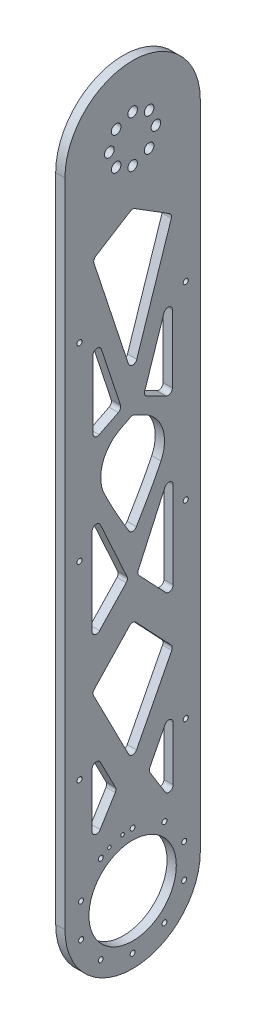
from build123d import *

# Parameters (mm, degrees)
SKETCH1_R                            = 3.3
SKETCH1_R_2                          = 1.7
SKETCH1_R_3                          = 26
BOSS_EXTRUDE1_DEPTH                  = 6.35
CUT_EXTRUDE1_DEPTH                   = 549.511460682
FILLET1_R                            = 3
SKETCH4_R                            = 1.75
CUT_EXTRUDE2_DEPTH                   = 549.511460792
SKETCH5_R                            = 1.2
CUT_EXTRUDE4_DEPTH                   = 549.511460792
BOSS_EXTRUDE2_START                  = -6.35
BOSS_EXTRUDE2_DEPTH                  = 6.35
TAP_DRILL_FOR_M3X0_5_TAP1_AT_2_COUNT = 2
TAP_DRILL_FOR_M3X0_5_TAP1_AT_2_PITCH = 13.03070812
CIRPATTERN1_COUNT                    = 2
CIRPATTERN1_ANGLE                    = 90
CUT_EXTRUDE5_DEPTH                   = 549.511460792
SKETCH10_R                           = 30
CUT_EXTRUDE6_DEPTH                   = 549.511460792
SKETCH11_W                           = 93
SKETCH11_H                           = 52.717688801
CUT_EXTRUDE7_DEPTH                   = 549.511460792
BOSS_EXTRUDE3_DEPTH                  = 6.35
SKETCH13_R                           = 1.75
CUT_EXTRUDE8_DEPTH                   = 549.511460792
SKETCH14_R                           = 1.75
BOSS_EXTRUDE4_DEPTH                  = 6.35


with BuildPart() as part:
    # Sketch1 → Boss-Extrude1 (new body)
    with BuildSketch(Plane(origin=(0, 0, 0), x_dir=(0, -1, 0), z_dir=(1, 0, 0))):
        with BuildLine():
            Line((0, 46.5), (500, 46.5))
            ThreePointArc((500, 46.5), (546.5, 0), (500, -46.5))
            Line((500, -46.5), (0, -46.5))
            ThreePointArc((0, -46.5), (-46.5, 0), (0, 46.5))
        make_face()
        with Locations(Location((-16, 0, 0), (0, 0, 90))):
            Circle(SKETCH1_R, mode=Mode.SUBTRACT)
        with Locations(Location((-11.313708499, 11.313708499, 0), (0, 0, 90))):
            Circle(SKETCH1_R, mode=Mode.SUBTRACT)
        with Locations(Location((0, 16, 0), (0, 0, 90))):
            Circle(SKETCH1_R, mode=Mode.SUBTRACT)
        with Locations(Location((11.313708499, 11.313708499, 0), (0, 0, 90))):
            Circle(SKETCH1_R, mode=Mode.SUBTRACT)
        with Locations(Location((16, 0, 0), (0, 0, 90))):
            Circle(SKETCH1_R, mode=Mode.SUBTRACT)
        with Locations(Location((11.313708499, -11.313708499, 0), (0, 0, 90))):
            Circle(SKETCH1_R, mode=Mode.SUBTRACT)
        with Locations(Location((537.25, 0, 0), (0, 0, 90))):
            Circle(SKETCH1_R_2, mode=Mode.SUBTRACT)
        with Locations(Location((530.13588304, -21.895000648, 0), (0, 0, 90))):
            Circle(SKETCH1_R_2, mode=Mode.SUBTRACT)
        with Locations(Location((511.51088304, -35.426855232, 0), (0, 0, 90))):
            Circle(SKETCH1_R_2, mode=Mode.SUBTRACT)
        with Locations(Location((488.48911696, -35.426855232, 0), (0, 0, 90))):
            Circle(SKETCH1_R_2, mode=Mode.SUBTRACT)
        with Locations(Location((469.86411696, -21.895000648, 0), (0, 0, 90))):
            Circle(SKETCH1_R_2, mode=Mode.SUBTRACT)
        with Locations(Location((462.75, 0, 0), (0, 0, 90))):
            Circle(SKETCH1_R_2, mode=Mode.SUBTRACT)
        with Locations(Location((469.86411696, 21.895000648, 0), (0, 0, 90))):
            Circle(SKETCH1_R_2, mode=Mode.SUBTRACT)
        with Locations(Location((488.48911696, 35.426855232, 0), (0, 0, 90))):
            Circle(SKETCH1_R_2, mode=Mode.SUBTRACT)
        with Locations(Location((511.51088304, 35.426855232, 0), (0, 0, 90))):
            Circle(SKETCH1_R_2, mode=Mode.SUBTRACT)
        with Locations(Location((530.13588304, 21.895000648, 0), (0, 0, 90))):
            Circle(SKETCH1_R_2, mode=Mode.SUBTRACT)
        with Locations(Location((500, 0, 0), (0, 0, 90))):
            Circle(SKETCH1_R_3, mode=Mode.SUBTRACT)
        with Locations(Location((0, -16, 0), (0, 0, 90))):
            Circle(SKETCH1_R, mode=Mode.SUBTRACT)
        with Locations(Location((-11.313708499, -11.313708499, 0), (0, 0, 90))):
            Circle(SKETCH1_R, mode=Mode.SUBTRACT)
    extrude(amount=BOSS_EXTRUDE1_DEPTH)

    # Sketch3 → Cut-Extrude1 (cut, through all)
    with BuildSketch(Plane(origin=(6.35, 0, 0), x_dir=(0, 0, -1), z_dir=(1, 0, 0))):
        Polygon((0, -422.848022722), (27.858212922, -368.632839363), (0, -339.139268075), (-27.858212922, -368.632839363), align=None)
        Polygon((0, -41.368651369), (-27.312924288, -58.435222232), (0, -141.248998295), (27.312924288, -58.435222232), align=None)
        Polygon((3, -313.189087212), (27.858212922, -339.506549748), (27.858212922, -258.646044282), align=None)
        Polygon((-27.858212922, -339.506549748), (-27.858212922, -258.646044282), (-3, -313.189087212), align=None)
        Polygon((-27.858212922, -401.452857349), (-11, -434.260816252), (-27.858212922, -461.481824785), align=None)
        Polygon((11, -434.260816252), (27.858212922, -461.481824785), (27.858212922, -401.452857349), align=None)
        with BuildLine():
            Line((0, -164.248853344), (-27.858212922, -178.200474573))
            add(Edge.make_bspline(
                [(-27.858212922, -178.200474573), (-43.7790539, -216.093343216), (-18.61661693, -258.276071598), (0, -289.085024731)],
                knots=[0, 0, 0, 0, 1, 1, 1, 1], degree=3))
            add(Edge.make_bspline(
                [(27.858212922, -178.200474573), (43.7790539, -216.093343216), (18.61661693, -258.276071598), (0, -289.085024731)],
                knots=[0, 0, 0, 0, 1, 1, 1, 1], degree=3))
            Line((27.858212922, -178.200474573), (0, -164.248853344))
        make_face()
        Polygon((7.5, -156.820958214), (27.312924288, -96.747453897), (27.312924288, -166.743432993), align=None)
        Polygon((-27.312924288, -96.747453897), (-27.312924288, -166.743432993), (-7.5, -156.820958214), align=None)
    extrude(amount=-CUT_EXTRUDE1_DEPTH, mode=Mode.SUBTRACT)

    # Fillet1
    fillet1_edges = [part.edges().sort_by_distance(p)[0] for p in [
        (3.175, -58.435222232, -27.312924288),
        (3.175, -41.368651369, 0),
        (3.175, -58.435222232, 27.312924288),
        (3.175, -141.248998295, 0),
        (3.175, -289.085024731, 0),
        (3.175, -164.248853344, 0),
        (3.175, -401.452857349, 27.858212922),
        (3.175, -434.260816252, 11),
        (3.175, -461.481824785, 27.858212922),
        (3.175, -461.481824785, -27.858212922),
        (3.175, -434.260816252, -11),
        (3.175, -401.452857349, -27.858212922),
        (3.175, -368.632839363, -27.858212922),
        (3.175, -339.139268075, 0),
        (3.175, -368.632839363, 27.858212922),
        (3.175, -422.848022722, 0),
        (3.175, -313.189087212, 3),
        (3.175, -339.506549748, 27.858212922),
        (3.175, -258.646044282, 27.858212922),
        (3.175, -178.200474573, -27.858212922),
        (3.175, -178.200474573, 27.858212922),
        (3.175, -339.506549748, -27.858212922),
        (3.175, -313.189087212, -3),
        (3.175, -258.646044282, -27.858212922),
        (3.175, -96.747453897, 27.312924288),
        (3.175, -166.743432993, 27.312924288),
        (3.175, -156.820958214, 7.5),
        (3.175, -166.743432993, -27.312924288),
        (3.175, -156.820958214, -7.5),
        (3.175, -96.747453897, -27.312924288),
    ]]
    fillet(fillet1_edges, radius=FILLET1_R)

    # Sketch4 → Cut-Extrude2 (cut, through all)
    with BuildSketch(Plane(origin=(6.35, 0, 0), x_dir=(0, 0, -1), z_dir=(1, 0, 0))):
        with Locations((-36.5, -103.175)):
            Circle(SKETCH4_R)
        with Locations(Location((36.5, -103.175, 0), (0, 0, 180))):
            Circle(SKETCH4_R)
        with Locations(Location((-36.5, -259.525, 0), (0, 0, 180))):
            Circle(SKETCH4_R)
        with Locations((36.5, -259.525)):
            Circle(SKETCH4_R)
        with Locations((-36.5, -415.875)):
            Circle(SKETCH4_R)
        with Locations(Location((36.5, -415.875, 0), (0, 0, 180))):
            Circle(SKETCH4_R)
    extrude(amount=-CUT_EXTRUDE2_DEPTH, mode=Mode.SUBTRACT)

    # Sketch5 → Cut-Extrude4 (cut, through all)
    with BuildSketch(Plane(origin=(6.35, 0, 0), x_dir=(0, 0, -1), z_dir=(1, 0, 0))):
        with Locations((-6.916110339, -463.343078174)):
            Circle(SKETCH5_R)
        with Locations((-15.951147244, -466.27873962)):
            Circle(SKETCH5_R)
    extrude(amount=-CUT_EXTRUDE4_DEPTH, mode=Mode.SUBTRACT)

    # Sketch6 → Boss-Extrude2 (add)
    with BuildSketch(Plane(origin=(6.35, 0, 0), x_dir=(0, 0, -1), z_dir=(1, 0, 0)).offset(BOSS_EXTRUDE2_START)):
        with BuildLine():
            Line((-44.110383395, -529.968247771), (-29.968247771, -544.110383395))
            ThreePointArc((-29.968247771, -544.110383395), (-23.286397782, -542.399293624), (-16.474718596, -543.483717035))
            ThreePointArc((-16.474718596, -543.483717035), (-32.880465325, -532.880465325), (-43.483717035, -516.474718596))
            ThreePointArc((-43.483717035, -516.474718596), (-42.399293624, -523.286397782), (-44.110383395, -529.968247771))
        make_face()
    boss_extrude2 = extrude(amount=BOSS_EXTRUDE2_DEPTH)

    # Sketch8 → Tap Drill for M3x0.5 Tap1 (revolve, cut)
    with BuildSketch(Plane(origin=(3.175, -532.796674896, 41.28195627), x_dir=(0, -0.7071067811865424, -0.7071067811865527), z_dir=(1, 0, 0))):
        Polygon((0, 0), (0, 5.751075774), (1.25, 5), (1.25, 0), align=None)
    tap_drill_for_m3x0_5_tap1 = revolve(axis=Axis((3.175, -537.286802956, 45.772084331), (0, 0.7071067811865529, -0.7071067811865422)), mode=Mode.SUBTRACT)

    # Tap Drill for M3x0.5 Tap1 at 2: Tap Drill for M3x0.5 Tap1 ×2
    with Locations(*[Vector(0, -0.7071067811865422, -0.7071067811865529) * (i * TAP_DRILL_FOR_M3X0_5_TAP1_AT_2_PITCH) for i in range(1, TAP_DRILL_FOR_M3X0_5_TAP1_AT_2_COUNT)]):
        add(tap_drill_for_m3x0_5_tap1, mode=Mode.SUBTRACT)

    # CirPattern1: Boss-Extrude2, Tap Drill for M3x0.5 Tap1 ×2 about axis
    cirpattern1_axis = Axis((0, -500, 0), (1, 0, 0))
    add([boss_extrude2.rotate(cirpattern1_axis, i * CIRPATTERN1_ANGLE / (CIRPATTERN1_COUNT - 1)) for i in range(1, CIRPATTERN1_COUNT)])
    add([tap_drill_for_m3x0_5_tap1.rotate(cirpattern1_axis, i * CIRPATTERN1_ANGLE / (CIRPATTERN1_COUNT - 1)) for i in range(1, CIRPATTERN1_COUNT)], mode=Mode.SUBTRACT)

    # CirPattern1 copy 1 sketch → CirPattern1 copy 1 (revolve, cut)
    with BuildSketch(Plane(origin=(3.175, -532.067854195, -42.010776971), x_dir=(0, 0.7071067811865551, -0.7071067811865399), z_dir=(1, 0, 0))):
        Polygon((0, 0), (0, 5.751075774), (1.25, 5), (1.25, 0), align=None)
    revolve(axis=Axis((3.175, -536.557982255, -46.500905032), (0, 0.7071067811865398, 0.7071067811865553)), mode=Mode.SUBTRACT)

    # Sketch9 → Cut-Extrude5 (cut, through all)
    with BuildSketch(Plane(origin=(6.35, 0, 0), x_dir=(0, 0, -1), z_dir=(1, 0, 0))):
        with BuildLine():
            Line((-43.483717035, -516.474718596), (-63.483717035, -516.474718596))
            ThreePointArc((-63.483717035, -516.474718596), (0, -565.586573942), (63.483717035, -516.474718596))
            Line((63.483717035, -516.474718596), (43.483717035, -516.474718596))
            ThreePointArc((43.483717035, -516.474718596), (0, -546.5), (-43.483717035, -516.474718596))
        make_face()
    extrude(amount=-CUT_EXTRUDE5_DEPTH, mode=Mode.SUBTRACT)

    # Sketch10 → Cut-Extrude6 (cut, through all)
    with BuildSketch(Plane(origin=(6.35, 0, 0), x_dir=(0, 0, -1), z_dir=(1, 0, 0))):
        with Locations((0, -500)):
            Circle(SKETCH10_R)
    extrude(amount=-CUT_EXTRUDE6_DEPTH, mode=Mode.SUBTRACT)

    # Sketch11 → Cut-Extrude7 (cut, through all)
    with BuildSketch(Plane.ZY):
        with Locations((0, -205.625859872)):
            Rectangle(SKETCH11_W, SKETCH11_H)
    extrude(amount=-CUT_EXTRUDE7_DEPTH, mode=Mode.SUBTRACT)


with BuildPart() as cut_extrude7_piece_1:
    # of the separate pieces the step leaves, piece 1, a body of its own (cut_extrude7_pieces)
    add(part.part.solids().sort_by_distance((0, -500, 46.5))[0])


with BuildPart() as cut_extrude7_piece_2:
    # of the separate pieces the step leaves, piece 2, a body of its own (cut_extrude7_pieces)
    add(part.part.solids().sort_by_distance((0, -179.267015471, 46.5))[0])


with BuildPart() as cut_extrude7_piece_2_1:
    # Body-Move/Copy1: moved
    add(cut_extrude7_piece_2.part.moved(Location((0, -52.7176888, 0))))

    # Combine1: union Cut-Extrude7 piece 1
    add(cut_extrude7_piece_1.part)

    # Sketch12 → Boss-Extrude3 (add)
    with BuildSketch(Plane.ZY):
        with BuildLine():
            Line((-8.107077378, -221.026632904), (-26.8521577, -230.414322677))
            ThreePointArc((-26.8521577, -230.414322677), (-27.717865763, -231.066969848), (-28.295067899, -231.984704273))
            add(Edge.make_bspline(
                [(-19.477332048, -254.141993575), (-22.908456866, -246.947780666), (-25.966776611, -239.522857913), (-28.295067899, -231.984704273)],
                knots=[0.341715687, 0.341715687, 0.341715687, 0.341715687, 0.53746001, 0.53746001, 0.53746001, 0.53746001], degree=3))
            ThreePointArc((-19.477332048, -254.141993575), (-20.557337263, -235.261485452), (-8.107077378, -221.026632904))
        make_face()
        with BuildLine():
            Line((8.107077378, -221.026632904), (26.8521577, -230.414322677))
            ThreePointArc((26.8521577, -230.414322677), (27.717865763, -231.066969847), (28.295067899, -231.984704271))
            add(Edge.make_bspline(
                [(28.295067899, -231.984704271), (25.966776612, -239.522857912), (22.908456866, -246.947780666), (19.477332048, -254.141993575)],
                knots=[0.46253999, 0.46253999, 0.46253999, 0.46253999, 0.658284313, 0.658284313, 0.658284313, 0.658284313], degree=3))
            ThreePointArc((19.477332048, -254.141993575), (20.557337263, -235.261485452), (8.107077378, -221.026632904))
        make_face()
    extrude(amount=-BOSS_EXTRUDE3_DEPTH)

    # Sketch13 → Cut-Extrude8 (cut, through all)
    with BuildSketch(Plane.ZY):
        with Locations((-36.5, -285.8838444)):
            Circle(SKETCH13_R)
        with Locations((36.5, -285.8838444)):
            Circle(SKETCH13_R)
    extrude(amount=-CUT_EXTRUDE8_DEPTH, mode=Mode.SUBTRACT)

    # Sketch14 → Boss-Extrude4 (add)
    with BuildSketch(Plane(origin=(6.35, 0, 0), x_dir=(0, 0, -1), z_dir=(1, 0, 0))):
        with Locations((36.5, -259.525)):
            Circle(SKETCH14_R)
        with Locations((-36.5, -259.525)):
            Circle(SKETCH14_R)
    extrude(amount=-BOSS_EXTRUDE4_DEPTH)


solid = cut_extrude7_piece_2_1.part
